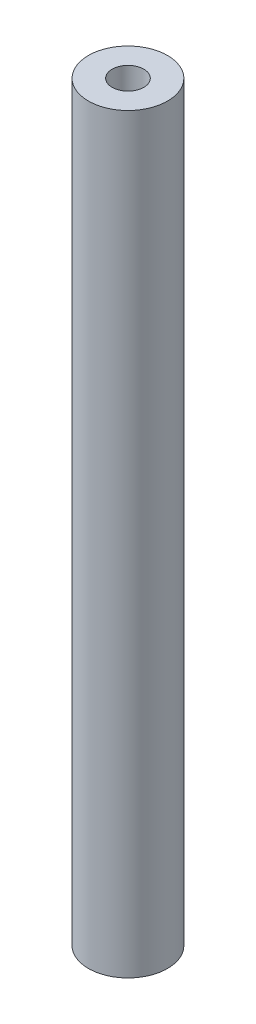
from build123d import *

# Parameters (mm, degrees)
SKETCH1_R           = 5
BOSS_EXTRUDE1_DEPTH = 103
SKETCH5_W           = 1
SKETCH5_H           = 4
SKETCH6_R           = 5
CUT_EXTRUDE1_DEPTH  = 20


with BuildPart() as part:
    # Sketch1 → Boss-Extrude1 (new body)
    with BuildSketch(Plane(origin=(0, 0, 0), x_dir=(1, 0, 0), z_dir=(0, 1, 0))):
        with Locations(Location((0, 0, 0), (0, 0, 270))):
            Circle(SKETCH1_R)
    extrude(amount=BOSS_EXTRUDE1_DEPTH)

    # Sketch4 → Ø4.0mm Dowel Hole1 (revolve, cut)
    with BuildSketch(Plane(origin=(0, 103, 0), x_dir=(0, 0, 1), z_dir=(1, 0, 0))):
        Polygon((0, 0), (0, 19.201721238), (2, 18), (2, 0.025), (2.025, 0), align=None)
    f_4_0mm_dowel_hole1 = revolve(axis=Axis((0, 109.35, 0), (0, -1, 0)), mode=Mode.SUBTRACT)

    # Mirror1: Ø4.0mm Dowel Hole1 across plane
    add(f_4_0mm_dowel_hole1.mirror(Plane.ZX.offset(51.5)), mode=Mode.SUBTRACT)

    # Sketch5 → Cut-Revolve2 (revolve, cut)
    with BuildSketch(Plane.XY):
        with Locations((-4.5, 101)):
            Rectangle(SKETCH5_W, SKETCH5_H)
        with Locations((-4.5, 2)):
            Rectangle(SKETCH5_W, SKETCH5_H)
    revolve(axis=Axis((0, 103, 0), (0, -1, 0)), mode=Mode.SUBTRACT)

    # Sketch6 → Cut-Extrude1 (cut)
    with BuildSketch(Plane(origin=(0, 99, 0), x_dir=(1, 0, 0), z_dir=(0, 1, 0))):
        with Locations(Location((0, 0, 0), (0, 0, 180))):
            Circle(SKETCH6_R)
    cut_extrude1 = extrude(amount=CUT_EXTRUDE1_DEPTH, mode=Mode.SUBTRACT)

    # Mirror3: Cut-Extrude1 across plane
    add(cut_extrude1.mirror(Plane.ZX.offset(51.5)), mode=Mode.SUBTRACT)


solid = part.part
